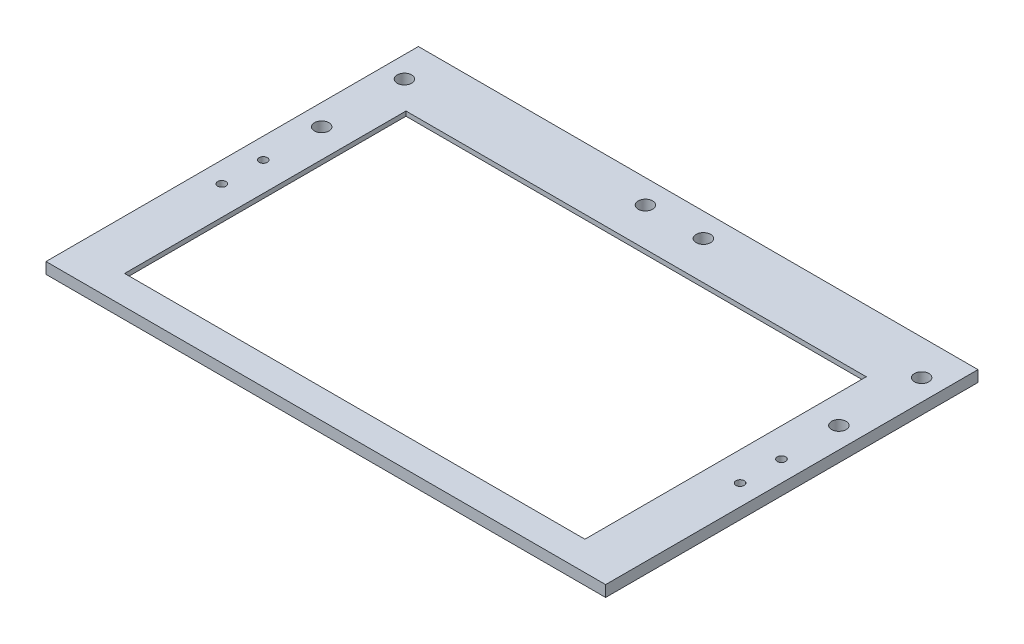
from build123d import *

# Parameters (mm, degrees)
SKETCH1_W           = 270.5
SKETCH1_H           = 180
SKETCH1_R           = 2
SKETCH1_R_2         = 3.5
SKETCH1_W_2         = 222.5
SKETCH1_H_2         = 136
BOSS_EXTRUDE1_DEPTH = 5.4
SKETCH1_5_W         = 230.5
SKETCH1_5_H         = 150
CUT_EXTRUDE1_DEPTH  = 3.2


with BuildPart() as part:
    # Sketch1 → Boss-Extrude1 (new body)
    with BuildSketch(Plane(origin=(0, 0, 0), x_dir=(1, 0, 0), z_dir=(0, 1, 0))):
        with Locations((0, 5)):
            Rectangle(SKETCH1_W, SKETCH1_H)
        with Locations(Location((-125.25, -10, 0), (0, 0, 90))):
            Circle(SKETCH1_R, mode=Mode.SUBTRACT)
        with Locations(Location((125.25, -10, 0), (0, 0, 90))):
            Circle(SKETCH1_R, mode=Mode.SUBTRACT)
        with Locations(Location((-125.25, 10, 0), (0, 0, 90))):
            Circle(SKETCH1_R, mode=Mode.SUBTRACT)
        with Locations(Location((-125, 38, 0), (0, 0, 90))):
            Circle(SKETCH1_R_2, mode=Mode.SUBTRACT)
        with Locations(Location((-125, 78, 0), (0, 0, 90))):
            Circle(SKETCH1_R_2, mode=Mode.SUBTRACT)
        with Locations(Location((-14, 83.5, 0), (0, 0, 90))):
            Circle(SKETCH1_R_2, mode=Mode.SUBTRACT)
        with Locations((0, -3)):
            Rectangle(SKETCH1_W_2, SKETCH1_H_2, mode=Mode.SUBTRACT)
        with Locations(Location((125.25, 10, 0), (0, 0, 90))):
            Circle(SKETCH1_R, mode=Mode.SUBTRACT)
        with Locations(Location((125, 38, 0), (0, 0, 90))):
            Circle(SKETCH1_R_2, mode=Mode.SUBTRACT)
        with Locations(Location((14, 83.5, 0), (0, 0, 90))):
            Circle(SKETCH1_R_2, mode=Mode.SUBTRACT)
        with Locations(Location((125, 78, 0), (0, 0, 90))):
            Circle(SKETCH1_R_2, mode=Mode.SUBTRACT)
    extrude(amount=BOSS_EXTRUDE1_DEPTH)

    # Sketch1<5> → Cut-Extrude1 (cut)
    with BuildSketch(Plane(origin=(0, 0, 0), x_dir=(1, 0, 0), z_dir=(0, 1, 0))):
        Rectangle(SKETCH1_5_W, SKETCH1_5_H)
    extrude(amount=CUT_EXTRUDE1_DEPTH, mode=Mode.SUBTRACT)


solid = part.part
